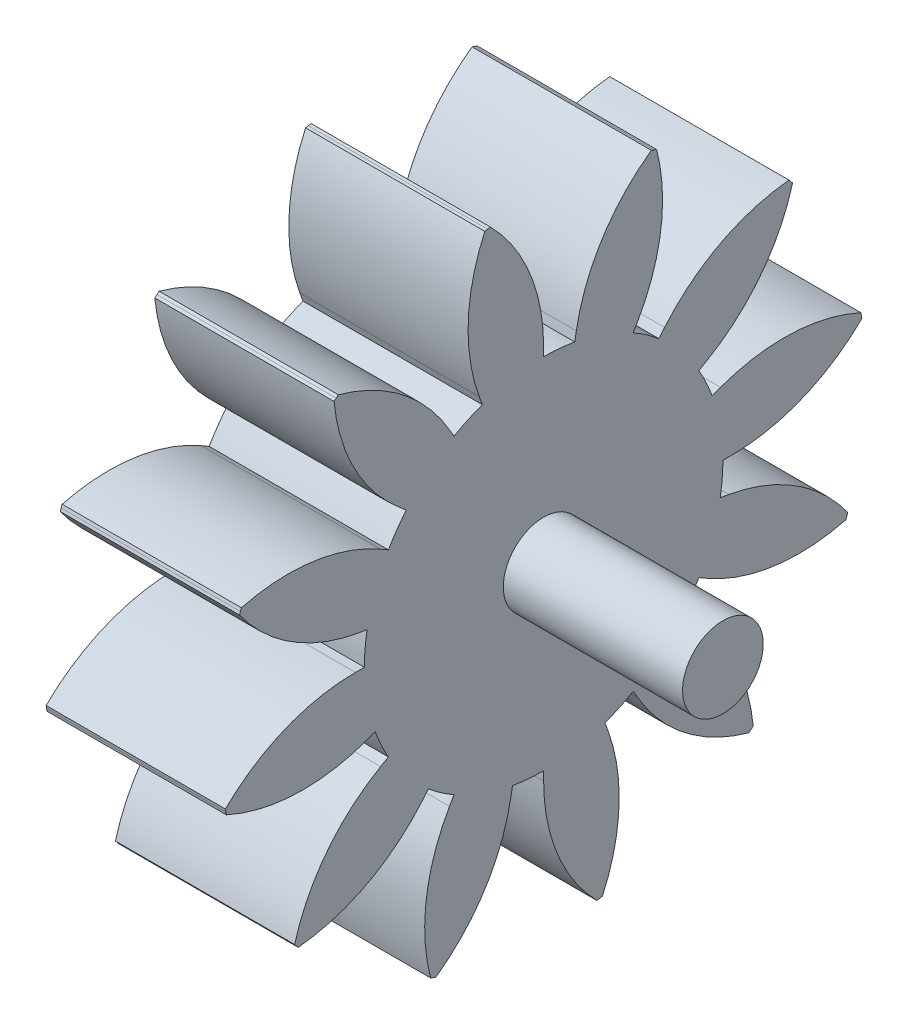
from build123d import *

# Parameters (mm, degrees)
SKETCH1_R           = 2.25
BOSS_EXTRUDE2_DEPTH = 10
SKETCH2_R           = 2.25
BOSS_EXTRUDE3_DEPTH = 10


with BuildPart() as part:
    # Sketch1 → Boss-Extrude2 (new body)
    with BuildSketch(Plane(origin=(0, 0, 0), x_dir=(0, 0, -1), z_dir=(1, 0, 0))):
        with BuildLine():
            Line((9.866772518, 3.591211505), (9.396926208, 3.420201433))
            ThreePointArc((9.396926208, 3.420201433), (9.06307787, 4.226182617), (8.660254038, 5))
            Line((8.660254038, 5), (9.09326674, 5.25))
            ThreePointArc((9.09326674, 5.25), (12.101465931, 7.877633315), (13.889242501, 11.449407965))
            Line((13.889242501, 11.449407965), (13.788799976, 11.570176974))
            Line((13.788799976, 11.570176974), (13.687307381, 11.69006487))
            ThreePointArc((13.687307381, 11.69006487), (9.85935187, 10.549680802), (6.749269902, 8.043466653))
            Line((6.749269902, 8.043466653), (6.427876097, 7.660444431))
            ThreePointArc((6.427876097, 7.660444431), (5.735764364, 8.191520443), (5, 8.660254038))
            Line((5, 8.660254038), (5.25, 9.09326674))
            ThreePointArc((5.25, 9.09326674), (6.541360261, 12.872963538), (6.303732863, 16.860099406))
            Line((6.303732863, 16.860099406), (6.15636258, 16.914467174))
            Line((6.15636258, 16.914467174), (6.008523466, 16.96754684))
            ThreePointArc((6.008523466, 16.96754684), (3.263608784, 14.065967511), (1.823305866, 10.340481407))
            Line((1.823305866, 10.340481407), (1.736481777, 9.84807753))
            ThreePointArc((1.736481777, 9.84807753), (0.871557427, 9.961946981), (0, 10))
            Line((0, 10), (0, 10.5))
            ThreePointArc((0, 10.5), (-0.771497607, 14.418993577), (-2.970856905, 17.753140828))
            Line((-2.970856905, 17.753140828), (-3.125667198, 17.726539554))
            Line((-3.125667198, 17.726539554), (-3.280239459, 17.698588336))
            ThreePointArc((-3.280239459, 17.698588336), (-4.206615641, 13.813289585), (-3.591211505, 9.866772518))
            Line((-3.591211505, 9.866772518), (-3.420201433, 9.396926208))
            ThreePointArc((-3.420201433, 9.396926208), (-4.226182617, 9.06307787), (-5, 8.660254038))
            Line((-5, 8.660254038), (-5.25, 9.09326674))
            ThreePointArc((-5.25, 9.09326674), (-7.877633315, 12.101465931), (-11.449407965, 13.889242501))
            Line((-11.449407965, 13.889242501), (-11.570176974, 13.788799976))
            Line((-11.570176974, 13.788799976), (-11.69006487, 13.687307381))
            ThreePointArc((-11.69006487, 13.687307381), (-10.549680802, 9.85935187), (-8.043466653, 6.749269902))
            Line((-8.043466653, 6.749269902), (-7.660444431, 6.427876097))
            ThreePointArc((-7.660444431, 6.427876097), (-8.191520443, 5.735764364), (-8.660254038, 5))
            Line((-8.660254038, 5), (-9.09326674, 5.25))
            ThreePointArc((-9.09326674, 5.25), (-12.872963538, 6.541360261), (-16.860099406, 6.303732863))
            Line((-16.860099406, 6.303732863), (-16.914467174, 6.15636258))
            Line((-16.914467174, 6.15636258), (-16.96754684, 6.008523466))
            ThreePointArc((-16.96754684, 6.008523466), (-14.065967511, 3.263608784), (-10.340481407, 1.823305866))
            Line((-10.340481407, 1.823305866), (-9.84807753, 1.736481777))
            ThreePointArc((-9.84807753, 1.736481777), (-9.961946981, 0.871557427), (-10, 0))
            Line((-10, 0), (-10.5, 0))
            ThreePointArc((-10.5, 0), (-14.418993577, -0.771497607), (-17.753140828, -2.970856905))
            Line((-17.753140828, -2.970856905), (-17.726539554, -3.125667198))
            Line((-17.726539554, -3.125667198), (-17.698588336, -3.280239459))
            ThreePointArc((-17.698588336, -3.280239459), (-13.813289585, -4.206615641), (-9.866772518, -3.591211505))
            Line((-9.866772518, -3.591211505), (-9.396926208, -3.420201433))
            ThreePointArc((-9.396926208, -3.420201433), (-9.06307787, -4.226182617), (-8.660254038, -5))
            Line((-8.660254038, -5), (-9.09326674, -5.25))
            ThreePointArc((-9.09326674, -5.25), (-12.101465931, -7.877633315), (-13.889242501, -11.449407965))
            Line((-13.889242501, -11.449407965), (-13.788799976, -11.570176974))
            Line((-13.788799976, -11.570176974), (-13.687307381, -11.69006487))
            ThreePointArc((-13.687307381, -11.69006487), (-9.85935187, -10.549680802), (-6.749269902, -8.043466653))
            Line((-6.749269902, -8.043466653), (-6.427876097, -7.660444431))
            ThreePointArc((-6.427876097, -7.660444431), (-5.735764364, -8.191520443), (-5, -8.660254038))
            Line((-5, -8.660254038), (-5.25, -9.09326674))
            ThreePointArc((-5.25, -9.09326674), (-6.541360261, -12.872963538), (-6.303732863, -16.860099406))
            Line((-6.303732863, -16.860099406), (-6.15636258, -16.914467174))
            Line((-6.15636258, -16.914467174), (-6.008523466, -16.96754684))
            ThreePointArc((-6.008523466, -16.96754684), (-3.263608784, -14.065967511), (-1.823305866, -10.340481407))
            Line((-1.823305866, -10.340481407), (-1.736481777, -9.84807753))
            ThreePointArc((-1.736481777, -9.84807753), (-0.871557427, -9.961946981), (0, -10))
            Line((0, -10), (0, -10.5))
            ThreePointArc((0, -10.5), (0.771497607, -14.418993577), (2.970856905, -17.753140828))
            Line((2.970856905, -17.753140828), (3.125667198, -17.726539554))
            Line((3.125667198, -17.726539554), (3.280239459, -17.698588336))
            ThreePointArc((3.280239459, -17.698588336), (4.206615641, -13.813289585), (3.591211505, -9.866772518))
            Line((3.591211505, -9.866772518), (3.420201433, -9.396926208))
            ThreePointArc((3.420201433, -9.396926208), (4.226182617, -9.06307787), (5, -8.660254038))
            Line((5, -8.660254038), (5.25, -9.09326674))
            ThreePointArc((5.25, -9.09326674), (7.877633315, -12.101465931), (11.449407965, -13.889242501))
            Line((11.449407965, -13.889242501), (11.570176974, -13.788799976))
            Line((11.570176974, -13.788799976), (11.69006487, -13.687307381))
            ThreePointArc((11.69006487, -13.687307381), (10.549680802, -9.85935187), (8.043466653, -6.749269902))
            Line((8.043466653, -6.749269902), (7.660444431, -6.427876097))
            ThreePointArc((7.660444431, -6.427876097), (8.191520443, -5.735764364), (8.660254038, -5))
            Line((8.660254038, -5), (9.09326674, -5.25))
            ThreePointArc((9.09326674, -5.25), (12.872963538, -6.541360261), (16.860099406, -6.303732863))
            Line((16.860099406, -6.303732863), (16.914467174, -6.15636258))
            Line((16.914467174, -6.15636258), (16.96754684, -6.008523466))
            ThreePointArc((16.96754684, -6.008523466), (14.065967511, -3.263608784), (10.340481407, -1.823305866))
            Line((10.340481407, -1.823305866), (9.84807753, -1.736481777))
            ThreePointArc((9.84807753, -1.736481777), (9.961946981, -0.871557427), (10, 0))
            Line((10, 0), (10.5, 0))
            ThreePointArc((10.5, 0), (14.418993577, 0.771497607), (17.753140828, 2.970856905))
            Line((17.753140828, 2.970856905), (17.726539554, 3.125667198))
            Line((17.726539554, 3.125667198), (17.698588336, 3.280239459))
            ThreePointArc((17.698588336, 3.280239459), (13.813289585, 4.206615641), (9.866772518, 3.591211505))
        make_face()
        Circle(SKETCH1_R, mode=Mode.SUBTRACT)
    extrude(amount=BOSS_EXTRUDE2_DEPTH)


with BuildPart() as body_2:
    # Sketch2 → Boss-Extrude3 (new body)
    with BuildSketch(Plane(origin=(10, 0, 0), x_dir=(0, 0, -1), z_dir=(1, 0, 0))):
        Circle(SKETCH2_R)
    extrude(amount=BOSS_EXTRUDE3_DEPTH)


solid = Compound([part.part, body_2.part])
